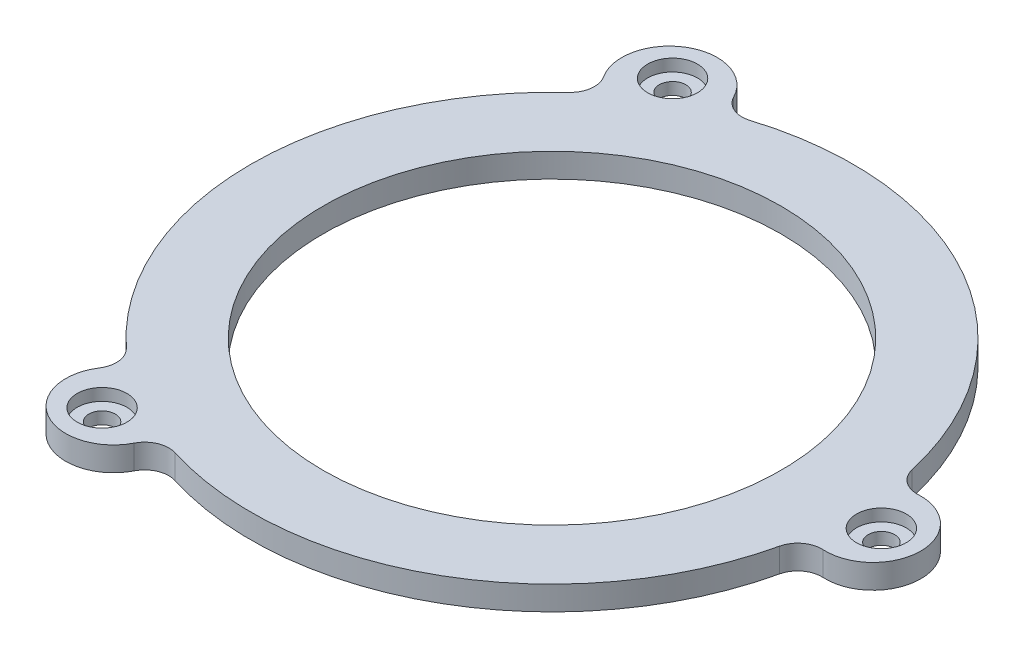
from build123d import *

# Parameters (mm, degrees)
SKETCH1_R           = 37.5
SKETCH1_R_2         = 28.5
BOSS_EXTRUDE1_DEPTH = 3
BOSS_EXTRUDE2_START = -3
BOSS_EXTRUDE2_DEPTH = 3
SKETCH6_R           = 1.65
CUT_EXTRUDE2_DEPTH  = 10
SKETCH7_R           = 3.1
CUT_EXTRUDE3_DEPTH  = 1.5
FILLET1_R           = 3


with BuildPart() as part:
    # Sketch1 → Boss-Extrude1 (new body)
    with BuildSketch(Plane(origin=(0, 0, 0), x_dir=(1, 0, 0), z_dir=(0, 1, 0))):
        with Locations(Location((0, 0, 0), (0, 0, 270))):
            Circle(SKETCH1_R)
        with Locations(Location((0, 0, 0), (0, 0, 270))):
            Circle(SKETCH1_R_2, mode=Mode.SUBTRACT)
    extrude(amount=BOSS_EXTRUDE1_DEPTH)

    # Sketch3 → Boss-Extrude2 (add)
    with BuildSketch(Plane(origin=(0, 3, 0), x_dir=(1, 0, 0), z_dir=(0, 1, 0)).offset(BOSS_EXTRUDE2_START)):
        with BuildLine():
            ThreePointArc((37.135052578, 5.218991286), (45.901049183, 0), (37.135052578, -5.218991286))
            ThreePointArc((37.135052578, -5.218991286), (37.5, 0), (37.135052578, 5.218991286))
        make_face()
        with BuildLine():
            ThreePointArc((-14.047747253, -34.769394546), (-22.950524592, -39.751474653), (-23.087305325, -29.55040326))
            ThreePointArc((-23.087305325, -29.55040326), (-18.75, -32.475952642), (-14.047747253, -34.769394546))
        make_face()
        with BuildLine():
            ThreePointArc((-23.087305325, 29.55040326), (-22.950524592, 39.751474653), (-14.047747253, 34.769394546))
            ThreePointArc((-14.047747253, 34.769394546), (-18.75, 32.475952642), (-23.087305325, 29.55040326))
        make_face()
    extrude(amount=BOSS_EXTRUDE2_DEPTH)

    # Sketch6 → Cut-Extrude2 (cut)
    with BuildSketch(Plane(origin=(0, 3, 0), x_dir=(1, 0, 0), z_dir=(0, 1, 0))):
        with Locations(Location((41, 0, 0), (0, 0, 270))):
            Circle(SKETCH6_R)
        with Locations(Location((-20.5, -35.507041555, 0), (0, 0, 270))):
            Circle(SKETCH6_R)
        with Locations(Location((-20.5, 35.507041555, 0), (0, 0, 270))):
            Circle(SKETCH6_R)
    extrude(amount=-CUT_EXTRUDE2_DEPTH, mode=Mode.SUBTRACT)

    # Sketch7 → Cut-Extrude3 (cut)
    with BuildSketch(Plane(origin=(0, 3, 0), x_dir=(1, 0, 0), z_dir=(0, 1, 0))):
        with Locations(Location((41, 0, 0), (0, 0, 270))):
            Circle(SKETCH7_R)
        with Locations(Location((-20.5, -35.507041555, 0), (0, 0, 270))):
            Circle(SKETCH7_R)
        with Locations(Location((-20.5, 35.507041555, 0), (0, 0, 270))):
            Circle(SKETCH7_R)
    extrude(amount=-CUT_EXTRUDE3_DEPTH, mode=Mode.SUBTRACT)

    # Fillet1
    fillet1_edges = [part.edges().sort_by_distance(p)[0] for p in [
        (37.135052578, 1.5, 5.218991286),
        (37.135052578, 1.5, -5.218991286),
        (-23.087305325, 1.5, 29.55040326),
        (-14.047747253, 1.5, 34.769394546),
        (-14.047747253, 1.5, -34.769394546),
        (-23.087305325, 1.5, -29.55040326),
    ]]
    fillet(fillet1_edges, radius=FILLET1_R)


solid = part.part
